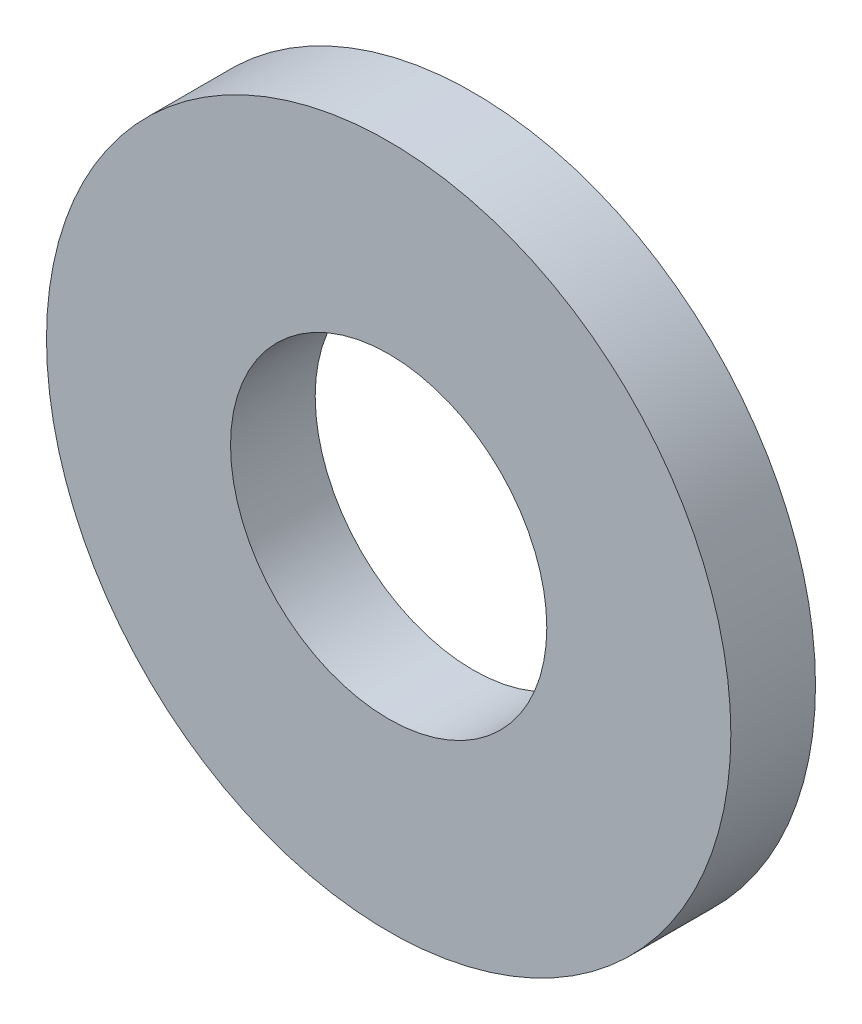
from build123d import *

# Parameters (mm, degrees)
SKETCH1_R           = 23.612475
SKETCH1_R_2         = 10.912475
BOSS_EXTRUDE1_DEPTH = 5.842


with BuildPart() as part:
    # Sketch1 → Boss-Extrude1 (new body)
    with BuildSketch(Plane.XY):
        Circle(SKETCH1_R)
        Circle(SKETCH1_R_2, mode=Mode.SUBTRACT)
    extrude(amount=BOSS_EXTRUDE1_DEPTH)


solid = part.part
